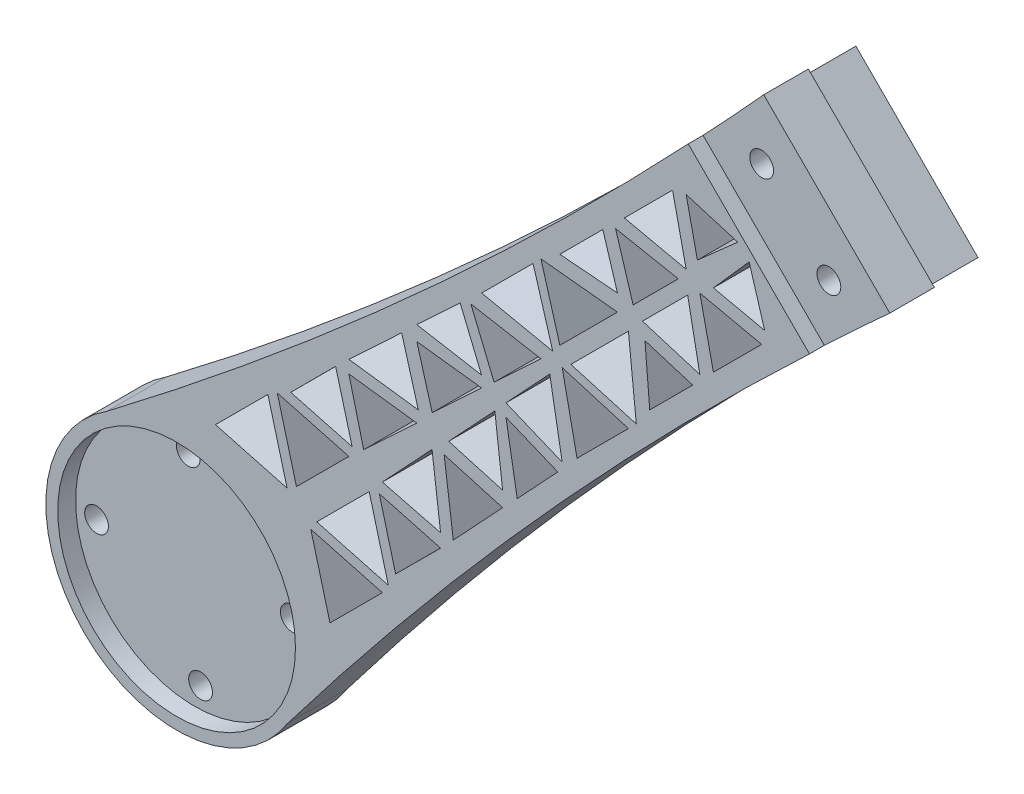
from build123d import *

# Parameters (mm, degrees)
BOSS_EXTRUDE1_DEPTH                  = 10
BOSS_EXTRUDE2_DEPTH                  = 5
SKETCH5_R                            = 20
CUT_EXTRUDE1_DEPTH                   = 3
SKETCH7_R                            = 2
CUT_EXTRUDE2_DEPTH                   = 245.329695289
CUT_EXTRUDE3_START                   = -2.5
CUT_EXTRUDE3_DEPTH                   = 2.5
SKETCH9_R                            = 2
CUT_EXTRUDE4_DEPTH                   = 245.37726981
BOSS_EXTRUDE3_REACH                  = 245.77
BOSS_EXTRUDE3_END_RADIUS             = 800
SKETCH10_W                           = 5
SKETCH10_H                           = 16
BOSS_EXTRUDE3_DIRECTION_2_REACH      = 245.77
BOSS_EXTRUDE3_DIRECTION_2_END_RADIUS = 800
CUT_EXTRUDE5_DEPTH                   = 245.63033336


with BuildPart() as part:
    # Sketch1 → Boss-Extrude1 (new body)
    with BuildSketch(Plane.XY):
        with BuildLine():
            Line((-53.725181106, -32.51197767), (-32.51197767, -53.725181106))
            ThreePointArc((-32.51197767, -53.725181106), (-84.43584578, -105.473072704), (-131.4048367, -161.756696044))
            ThreePointArc((-131.4048367, -161.756696044), (-165.556349186, -165.556349186), (-161.756696044, -131.4048367))
            ThreePointArc((-161.756696044, -131.4048367), (-105.473072704, -84.43584578), (-53.725181106, -32.51197767))
        make_face()
    extrude(amount=BOSS_EXTRUDE1_DEPTH)

    # Sketch5 → Cut-Extrude1 (cut)
    with BuildSketch(Plane.XY.offset(10)):
        with Locations((-150, -150)):
            Circle(SKETCH5_R)
    extrude(amount=-CUT_EXTRUDE1_DEPTH, mode=Mode.SUBTRACT)

    # Sketch7 → Cut-Extrude2 (cut, through all)
    with BuildSketch(Plane.XY.offset(7)):
        with Locations((-166.467430068, -151.036217613)):
            Circle(SKETCH7_R)
        with Locations((-151.036217613, -133.532569932)):
            Circle(SKETCH7_R)
        with Locations((-133.532569932, -148.963782387)):
            Circle(SKETCH7_R)
        with Locations((-148.963782387, -166.467430068)):
            Circle(SKETCH7_R)
    extrude(amount=-CUT_EXTRUDE2_DEPTH, mode=Mode.SUBTRACT)

    # Sketch8 → Cut-Extrude3 (cut)
    with BuildSketch(Plane.XY.offset(10).offset(CUT_EXTRUDE3_START)):
        with BuildLine():
            ThreePointArc((-53.725181106, -32.51197767), (-58.800243607, -38.041617861), (-63.926960875, -43.523401337))
            Line((-63.926960875, -43.523401337), (-43.523401337, -63.926960875))
            ThreePointArc((-43.523401337, -63.926960875), (-38.041617861, -58.800243607), (-32.51197767, -53.725181106))
            Line((-32.51197767, -53.725181106), (-53.725181106, -32.51197767))
        make_face()
    extrude(amount=CUT_EXTRUDE3_DEPTH, mode=Mode.SUBTRACT)

    # Sketch9 → Cut-Extrude4 (cut, through all)
    with BuildSketch(Plane.XY.offset(7.5)):
        with Locations((-54.077784983, -42.764076484)):
            Circle(SKETCH9_R)
        with Locations((-42.764076484, -54.077784983)):
            Circle(SKETCH9_R)
    extrude(amount=-CUT_EXTRUDE4_DEPTH, mode=Mode.SUBTRACT)

    # Sketch11 → Cut-Extrude5 (cut, through all)
    with BuildSketch(Plane.XY.offset(10)):
        Polygon((-133.063682372, -114.379119695), (-129.836922908, -126.421549962), (-121.021252106, -117.60587916), align=None)
        Polygon((-131.412745558, -127.425424466), (-134.639505023, -115.382994199), (-143.455175824, -124.198665001), align=None)
        Polygon((-121.021252106, -105.588274341), (-118.529065809, -115.382994199), (-109.590217466, -107.029504625), align=None)
        Polygon((-123.24979044, -105.588274341), (-130.797680236, -113.156969968), (-120.469052652, -115.909286462), align=None)
        Polygon((-121.021252106, -103.453965288), (-112.140585737, -95.154847651), (-109.333620391, -104.994319762), align=None)
        Polygon((-109.590217466, -95.154847651), (-107.00296521, -104.224142525), (-98.697266452, -96.462340856), align=None)
        Polygon((-109.590217466, -92.690573255), (-102.298737686, -85.876574628), (-98.697266452, -94.592518287), align=None)
        Polygon((-97.863320396, -81.81794377), (-90.035599808, -73.990223182), (-86.721041856, -85.132501722), (-98.697266452, -82.630998805), align=None)
        Polygon((-100.498002069, -85.132501722), (-96.589076212, -94.592518287), (-88.705275198, -87.224986468), align=None)
        Polygon((-88.705275198, -72.663490879), (-85.524709977, -83.675368995), (-75.839564165, -73.990223182), align=None)
        Polygon((-85.524709977, -70.408045964), (-78.294018925, -63.177354912), (-75.839564165, -71.204085345), align=None)
        Polygon((-76.151448432, -61.974425213), (-73.200251229, -71.625637689), (-65.599114287, -64.024500748), align=None)
        Polygon((-74.67584983, -59.688369594), (-66.56343802, -51.575957784), (-64.277382401, -61.974425213), align=None)
        Polygon((-64.277382401, -51.073378886), (-62.383416002, -59.688369594), (-55.593175908, -53.679881002), align=None)
    cut_extrude5 = extrude(amount=-CUT_EXTRUDE5_DEPTH, mode=Mode.SUBTRACT)

    # Mirror1: Cut-Extrude5 across plane
    add(cut_extrude5.mirror(Plane(origin=(0, 0, 0), x_dir=(0, 0, 1), z_dir=(-0.7071067811865469, 0.7071067811865481, 0))), mode=Mode.SUBTRACT)


with BuildPart() as body_2:
    # Sketch4 → Boss-Extrude2 (new, symmetric)
    with BuildSketch(Plane(origin=(0, 0, 0), x_dir=(0.7071067811865481, 0.7071067811865469, 0), z_dir=(0.7071067811865469, -0.7071067811865481, 0))):
        with BuildLine():
            Line((-225.531437003, 0), (-221.991852446, -13.747992553))
            ThreePointArc((-221.991852446, -13.747992553), (-220.924534017, -15.37107335), (-219.086597356, -16))
            Line((-219.086597356, -16), (-215.412046286, -16))
            Line((-215.412046286, -16), (-215.412046286, 0))
            Line((-215.412046286, 0), (-225.531437003, 0))
        make_face()
    extrude(amount=BOSS_EXTRUDE2_DEPTH, both=True)


with BuildPart() as body_3:
    # Boss-Extrude3: up to this cylinder (the profile starts outside it)
    boss_extrude3_end = Plane(origin=(505.657439071, -645.648891464, -8), z_dir=(0, 0, -1)) * Cylinder(BOSS_EXTRUDE3_END_RADIUS, 2092.54, mode=Mode.PRIVATE)
    # Sketch10 → Boss-Extrude3 (new, up to the surface)
    with BuildSketch(Plane(origin=(0, 0, 0), x_dir=(0.7071067811865481, 0.7071067811865469, 0), z_dir=(0.7071067811865469, -0.7071067811865481, 0)), mode=Mode.PRIVATE) as boss_extrude3_sk1:
        with Locations((-75.26259993, -8)):
            Rectangle(SKETCH10_W, SKETCH10_H)
    boss_extrude3_tool1 = extrude(boss_extrude3_sk1.sketch, amount=BOSS_EXTRUDE3_REACH, mode=Mode.PRIVATE) - boss_extrude3_end
    add(boss_extrude3_tool1.solids().sort_by_distance((-53.218695, -53.218695, -8))[0])

    # Boss-Extrude3 direction 2: up to this cylinder (the profile starts outside it)
    boss_extrude3_direction_2_end = Plane(origin=(-645.648891464, 505.657439071, -8), z_dir=(0, 0, -1)) * Cylinder(BOSS_EXTRUDE3_DIRECTION_2_END_RADIUS, 2092.54, mode=Mode.PRIVATE)
    # Sketch10 → Boss-Extrude3 direction 2 (add, up to the surface)
    with BuildSketch(Plane(origin=(0, 0, 0), x_dir=(0.7071067811865481, 0.7071067811865469, 0), z_dir=(0.7071067811865469, -0.7071067811865481, 0)), mode=Mode.PRIVATE) as boss_extrude3_direction_2_sk1:
        with Locations((-75.26259993, -8)):
            Rectangle(SKETCH10_W, SKETCH10_H)
    boss_extrude3_direction_2_tool1 = extrude(boss_extrude3_direction_2_sk1.sketch, amount=-BOSS_EXTRUDE3_DIRECTION_2_REACH, mode=Mode.PRIVATE) - boss_extrude3_direction_2_end
    add(boss_extrude3_direction_2_tool1.solids().sort_by_distance((-53.218695, -53.218695, -8))[0])


solid = Compound([part.part, body_2.part, body_3.part])
